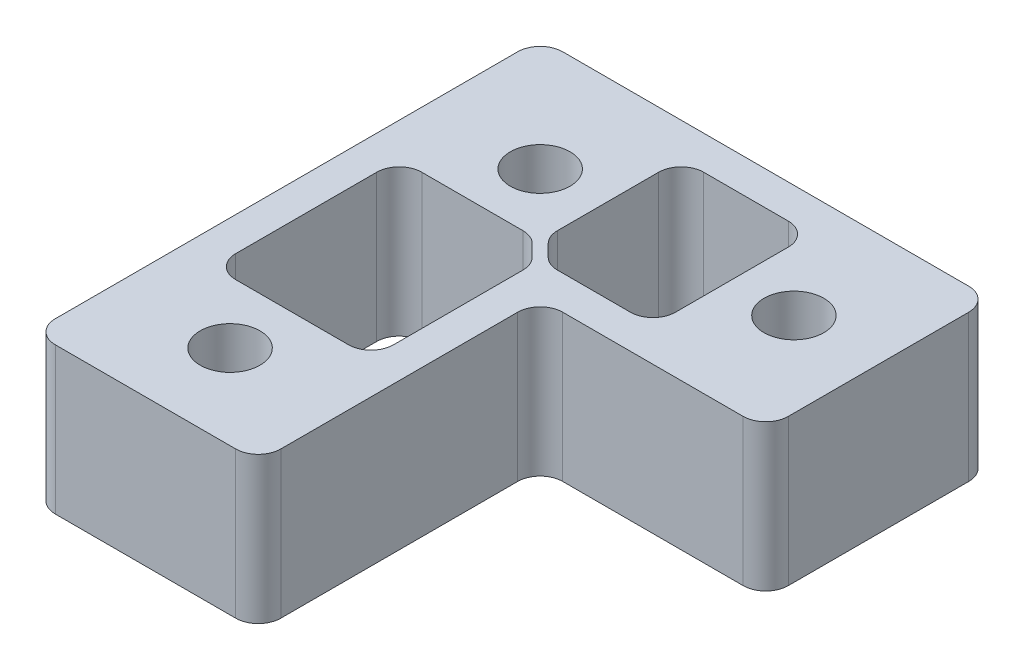
from build123d import *

# Parameters (mm, degrees)
SKETCH1_R           = 2.65
BOSS_EXTRUDE1_DEPTH = 13
CUT_EXTRUDE1_DEPTH  = 48.895720059
FILLET1_R           = 2


with BuildPart() as part:
    # Sketch1 → Boss-Extrude1 (new body)
    with BuildSketch(Plane(origin=(0, 0, 0), x_dir=(1, 0, 0), z_dir=(0, 1, 0))):
        Polygon((-10, 10), (-10, -35), (10, -35), (10, -10), (30, -10), (30, 10), align=None)
        with Locations(Location((0, 0, 0), (0, 0, 90))):
            Circle(SKETCH1_R, mode=Mode.SUBTRACT)
        with Locations(Location((0, -27.5, 0), (0, 0, 90))):
            Circle(SKETCH1_R, mode=Mode.SUBTRACT)
        with Locations(Location((22.5, 0, 0), (0, 0, 90))):
            Circle(SKETCH1_R, mode=Mode.SUBTRACT)
    extrude(amount=BOSS_EXTRUDE1_DEPTH)

    # Sketch2 → Cut-Extrude1 (cut, through all)
    with BuildSketch(Plane(origin=(0, 13, 0), x_dir=(1, 0, 0), z_dir=(0, 1, 0))):
        Polygon((-7, -5.5), (4.792893219, -5.5), (7, -7.707106781), (7, -22), (-7, -22), align=None)
        Polygon((17, 7), (5.5, 7), (5.5, -4.792893219), (7.707106781, -7), (17, -7), align=None)
    extrude(amount=-CUT_EXTRUDE1_DEPTH, mode=Mode.SUBTRACT)

    # Fillet1
    fillet1_edges = [part.edges().sort_by_distance(p)[0] for p in [
        (30, 6.5, -10),
        (30, 6.5, 10),
        (10, 6.5, 10),
        (10, 6.5, 35),
        (-10, 6.5, 35),
        (-10, 6.5, -10),
        (7.707106781, 6.5, 7),
        (5.5, 6.5, 4.792893219),
        (5.5, 6.5, -7),
        (17, 6.5, -7),
        (17, 6.5, 7),
        (-7, 6.5, 22),
        (-7, 6.5, 5.5),
        (4.792893219, 6.5, 5.5),
        (7, 6.5, 7.707106781),
        (7, 6.5, 22),
    ]]
    fillet(fillet1_edges, radius=FILLET1_R)


solid = part.part
